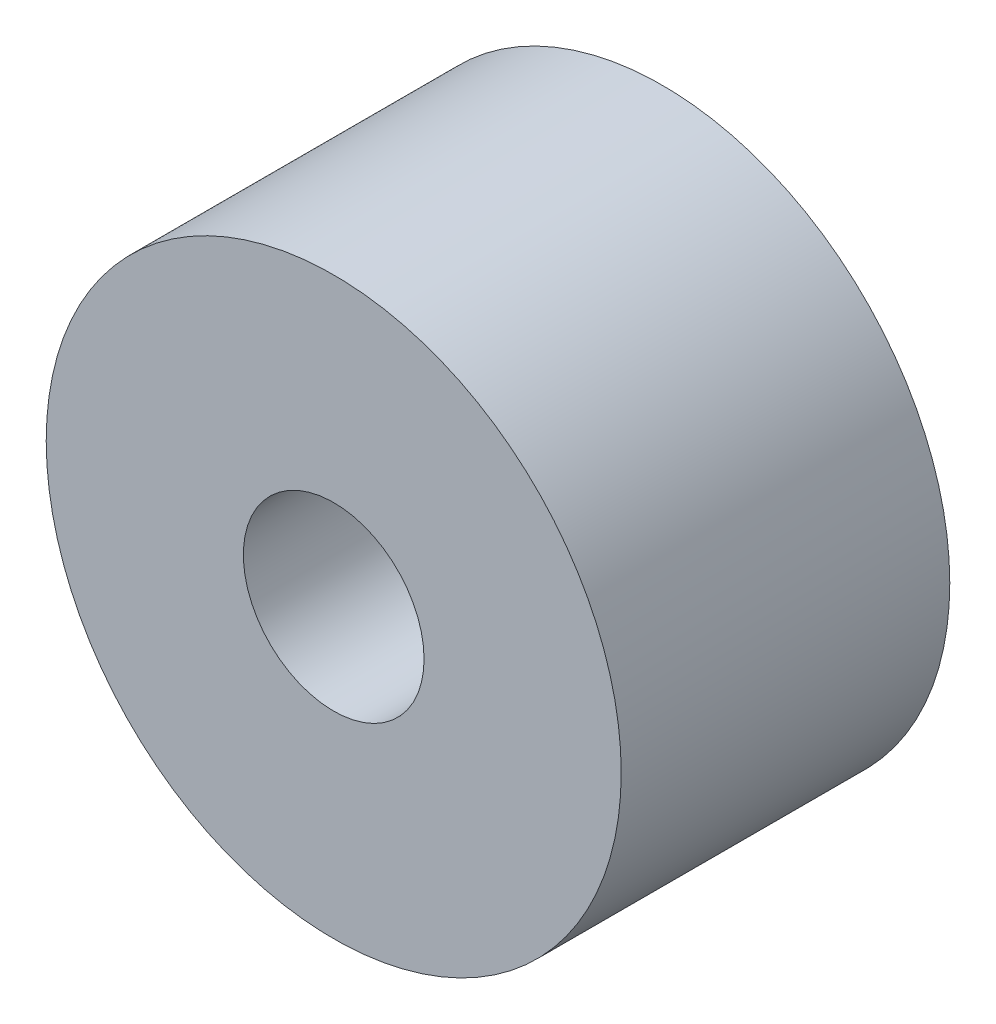
from build123d import *

# Parameters (mm, degrees)
SKETCH1_R           = 4.375
SKETCH1_R_2         = 1.375
BOSS_EXTRUDE1_DEPTH = 5


with BuildPart() as part:
    # Sketch1 → Boss-Extrude1 (new body)
    with BuildSketch(Plane.XY):
        Circle(SKETCH1_R)
        Circle(SKETCH1_R_2, mode=Mode.SUBTRACT)
    extrude(amount=BOSS_EXTRUDE1_DEPTH)


solid = part.part
